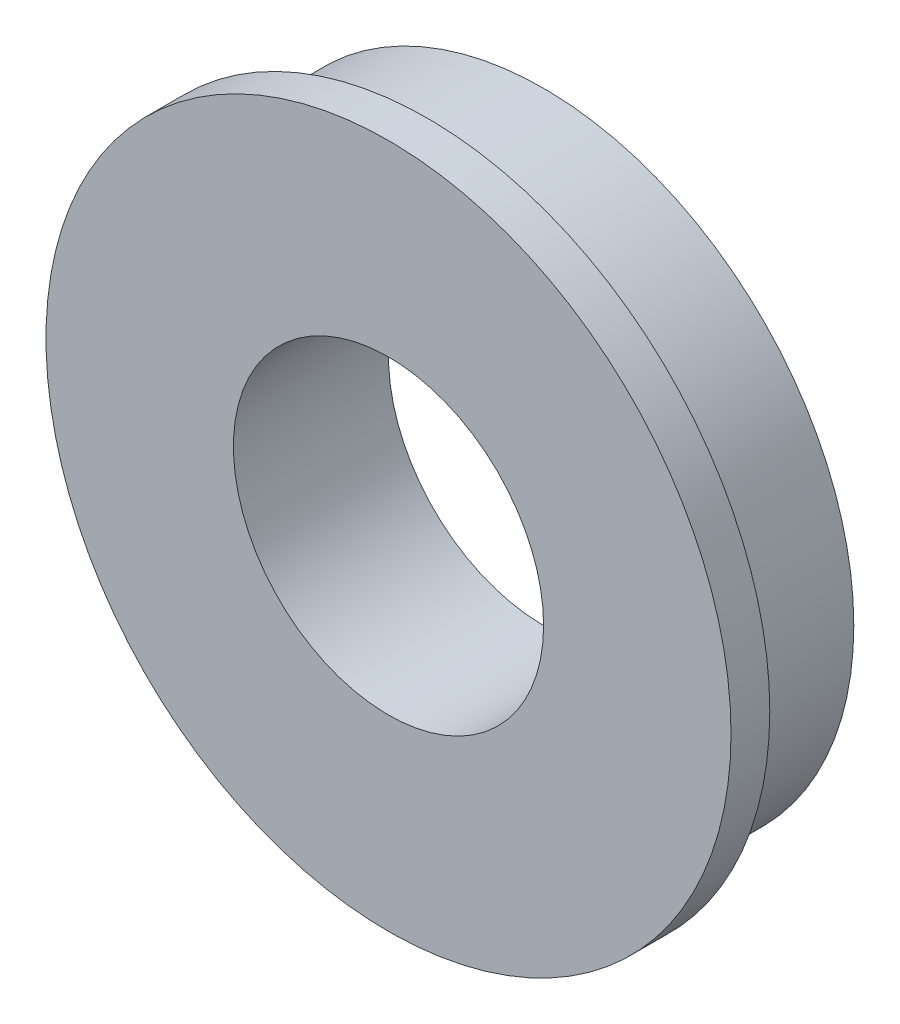
from build123d import *

# Parameters (mm, degrees)
SKETCH_1_R          = 12
EXTRUDE_1_DEPTH     = 4.5
SKETCH_2_R          = 13.25
EXTRUDE_2_DEPTH     = 1.5
SKETCH_3_R          = 6
CUT_EXTRUDE_1_DEPTH = 20.67549237


with BuildPart() as part:
    # ｽｹｯﾁ1 → 押し出し1 (new body)
    with BuildSketch(Plane.XY):
        Circle(SKETCH_1_R)
    extrude(amount=-EXTRUDE_1_DEPTH)

    # ｽｹｯﾁ2 → 押し出し2 (add)
    with BuildSketch(Plane.XY):
        Circle(SKETCH_2_R)
    extrude(amount=EXTRUDE_2_DEPTH)

    # ｽｹｯﾁ3 → ｶｯﾄ - 押し出し1 (cut, through all)
    with BuildSketch(Plane.XY.offset(1.5)):
        Circle(SKETCH_3_R)
    extrude(amount=-CUT_EXTRUDE_1_DEPTH, mode=Mode.SUBTRACT)


solid = part.part
